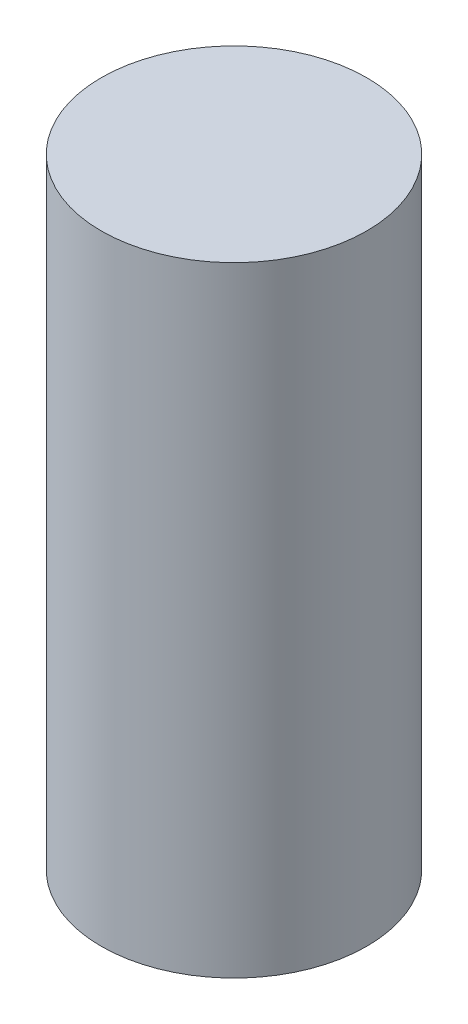
from build123d import *

# Parameters (mm, degrees)
PACK_AYAR_MIL_4_START = 12
SKETCH1_R             = 6
PACK_AYAR_MIL_4_DEPTH = 28


with BuildPart() as part:
    # Sketch1 → PACK_ayar_mil_4 (new body)
    with BuildSketch(Plane(origin=(0, 0, 0), x_dir=(1, 0, 0), z_dir=(0, 1, 0)).offset(PACK_AYAR_MIL_4_START)):
        with Locations(Location((650, 770, 0), (0, 0, 270))):
            Circle(SKETCH1_R)
    extrude(amount=PACK_AYAR_MIL_4_DEPTH)


solid = part.part
